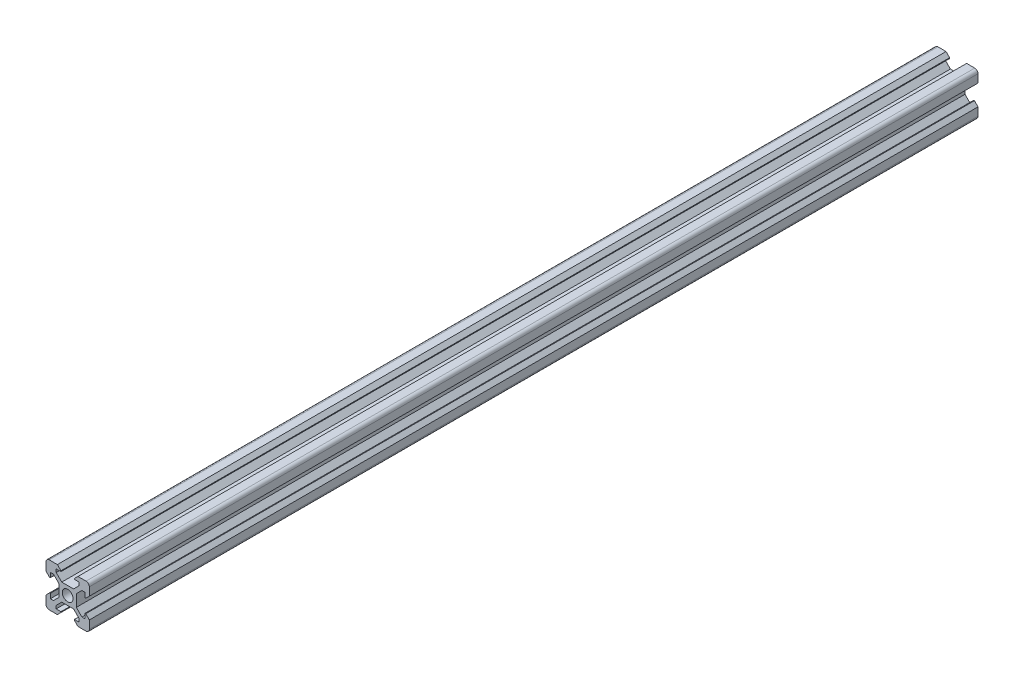
from build123d import *

# Parameters (mm, degrees)
SKETCH2_R           = 2.5
BOSS_EXTRUDE1_DEPTH = 410


with BuildPart() as part:
    # Sketch2 → Boss-Extrude1 (new body)
    with BuildSketch(Plane.XY):
        with BuildLine():
            Line((-4, -2.727207794), (-4, 2.727207794))
            Line((-4, 2.727207794), (-6.572792206, 5.3))
            Line((-6.572792206, 5.3), (-8, 5.3))
            Line((-8, 5.3), (-8, 3.1))
            Line((-8, 3.1), (-8.35, 3.1))
            Line((-8.35, 3.1), (-10, 4.75))
            Line((-10, 4.75), (-10, 8.5))
            ThreePointArc((-10, 8.5), (-9.560660172, 9.560660172), (-8.5, 10))
            Line((-8.5, 10), (-4.75, 10))
            Line((-4.75, 10), (-3.1, 8.35))
            Line((-3.1, 8.35), (-3.1, 8))
            Line((-3.1, 8), (-5.3, 8))
            Line((-5.3, 8), (-5.3, 6.572792206))
            Line((-5.3, 6.572792206), (-2.727207794, 4))
            Line((-2.727207794, 4), (2.727207794, 4))
            Line((2.727207794, 4), (5.3, 6.572792206))
            Line((5.3, 6.572792206), (5.3, 8))
            Line((5.3, 8), (3.1, 8))
            Line((3.1, 8), (3.1, 8.35))
            Line((3.1, 8.35), (4.75, 10))
            Line((4.75, 10), (8.5, 10))
            ThreePointArc((8.5, 10), (9.560660172, 9.560660172), (10, 8.5))
            Line((10, 8.5), (10, 4.75))
            Line((10, 4.75), (8.35, 3.1))
            Line((8.35, 3.1), (8, 3.1))
            Line((8, 3.1), (8, 5.3))
            Line((8, 5.3), (6.572792206, 5.3))
            Line((6.572792206, 5.3), (4, 2.727207794))
            Line((4, 2.727207794), (4, -2.727207794))
            Line((4, -2.727207794), (6.572792206, -5.3))
            Line((6.572792206, -5.3), (8, -5.3))
            Line((8, -5.3), (8, -3.1))
            Line((8, -3.1), (8.35, -3.1))
            Line((8.35, -3.1), (10, -4.75))
            Line((10, -4.75), (10, -8.5))
            ThreePointArc((10, -8.5), (9.560660172, -9.560660172), (8.5, -10))
            Line((8.5, -10), (4.75, -10))
            Line((4.75, -10), (3.1, -8.35))
            Line((3.1, -8.35), (3.1, -8))
            Line((3.1, -8), (5.3, -8))
            Line((5.3, -8), (5.3, -6.572792206))
            Line((5.3, -6.572792206), (2.727207794, -4))
            Line((2.727207794, -4), (-2.727207794, -4))
            Line((-2.727207794, -4), (-5.3, -6.572792206))
            Line((-5.3, -6.572792206), (-5.3, -8))
            Line((-5.3, -8), (-3.1, -8))
            Line((-3.1, -8), (-3.1, -8.35))
            Line((-3.1, -8.35), (-4.75, -10))
            Line((-4.75, -10), (-8.5, -10))
            ThreePointArc((-8.5, -10), (-9.560660172, -9.560660172), (-10, -8.5))
            Line((-10, -8.5), (-10, -4.75))
            Line((-10, -4.75), (-8.35, -3.1))
            Line((-8.35, -3.1), (-8, -3.1))
            Line((-8, -3.1), (-8, -5.3))
            Line((-8, -5.3), (-6.572792206, -5.3))
            Line((-6.572792206, -5.3), (-4, -2.727207794))
        make_face()
        Circle(SKETCH2_R, mode=Mode.SUBTRACT)
    extrude(amount=BOSS_EXTRUDE1_DEPTH)


solid = part.part
